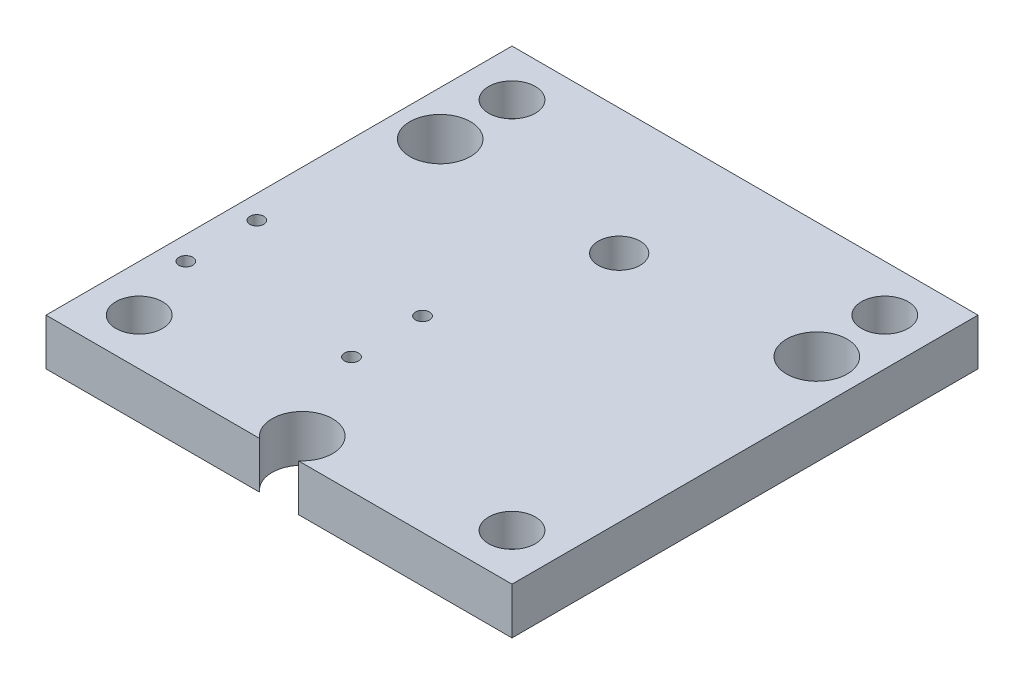
from build123d import *

# Parameters (mm, degrees)
SKETCH_1_W          = 100
SKETCH_1_H          = 100
EXTRUDE_1_DEPTH     = 10
SKETCH_2_R          = 5
CUT_EXTRUDE_1_DEPTH = 7
SKETCH_3_R          = 6.5
CUT_EXTRUDE_2_DEPTH = 142.774468788
SKETCH_4_R          = 4.5
CUT_EXTRUDE_3_DEPTH = 142.774468788
SKETCH_5_R          = 6.5
CUT_EXTRUDE_4_DEPTH = 3
SKETCH_6_R          = 1.5
CUT_EXTRUDE_5_DEPTH = 142.774468788
SKETCH_7_R          = 1.4
CUT_EXTRUDE_6_DEPTH = 5


with BuildPart() as part:
    # 草图1 → 凸台-拉伸1 (new body)
    with BuildSketch(Plane(origin=(0, 0, 0), x_dir=(1, 0, 0), z_dir=(0, 1, 0))):
        with Locations((50, -50)):
            Rectangle(SKETCH_1_W, SKETCH_1_H)
    extrude(amount=EXTRUDE_1_DEPTH)

    # 草图2 → 切除-拉伸1 (cut)
    with BuildSketch(Plane(origin=(0, 10, 0), x_dir=(1, 0, 0), z_dir=(0, 1, 0))):
        with Locations(Location((10, -10, 0), (0, 0, 270))):
            Circle(SKETCH_2_R)
        with Locations(Location((90, -10, 0), (0, 0, 270))):
            Circle(SKETCH_2_R)
        with Locations(Location((10, -90, 0), (0, 0, 270))):
            Circle(SKETCH_2_R)
        with Locations(Location((90, -90, 0), (0, 0, 270))):
            Circle(SKETCH_2_R)
    extrude(amount=-CUT_EXTRUDE_1_DEPTH, mode=Mode.SUBTRACT)

    # 草图3 → 切除-拉伸2 (cut, through all)
    with BuildSketch(Plane(origin=(0, 10, 0), x_dir=(1, 0, 0), z_dir=(0, 1, 0))):
        with Locations((50, -95)):
            Circle(SKETCH_3_R)
        with Locations(Location((90.414518843, -25, 0), (0, 0, 270))):
            Circle(SKETCH_3_R)
        with Locations(Location((9.585481157, -25, 0), (0, 0, 270))):
            Circle(SKETCH_3_R)
    extrude(amount=-CUT_EXTRUDE_2_DEPTH, mode=Mode.SUBTRACT)

    # 草图4 → 切除-拉伸3 (cut, through all)
    with BuildSketch(Plane(origin=(0, 10, 0), x_dir=(1, 0, 0), z_dir=(0, 1, 0))):
        with Locations(Location((50, -27, 0), (0, 0, 270))):
            Circle(SKETCH_4_R)
    extrude(amount=-CUT_EXTRUDE_3_DEPTH, mode=Mode.SUBTRACT)

    # 草图5 → 切除-拉伸4 (cut)
    with BuildSketch(Plane(origin=(0, 0, 0), x_dir=(-1, 0, 0), z_dir=(0, -1, 0))):
        with Locations(Location((-50, -27, 0), (0, 0, 90))):
            Circle(SKETCH_5_R)
    extrude(amount=-CUT_EXTRUDE_4_DEPTH, mode=Mode.SUBTRACT)

    # 草图6 → 切除-拉伸5 (cut, through all)
    with BuildSketch(Plane(origin=(0, 10, 0), x_dir=(1, 0, 0), z_dir=(0, 1, 0))):
        with Locations(Location((40.56, -59.76, 0), (0, 0, 270))):
            Circle(SKETCH_6_R)
        with Locations(Location((40.56, -75, 0), (0, 0, 270))):
            Circle(SKETCH_6_R)
        with Locations(Location((5, -59.76, 0), (0, 0, 270))):
            Circle(SKETCH_6_R)
        with Locations(Location((5, -75, 0), (0, 0, 270))):
            Circle(SKETCH_6_R)
    extrude(amount=-CUT_EXTRUDE_5_DEPTH, mode=Mode.SUBTRACT)

    # 草图7 → 切除-拉伸6 (cut)
    with BuildSketch(Plane(origin=(0, 0, 0), x_dir=(-1, 0, 0), z_dir=(0, -1, 0))):
        with Locations(Location((-65, -27, 0), (0, 0, 90))):
            Circle(SKETCH_7_R)
        with Locations(Location((-35, -27, 0), (0, 0, 90))):
            Circle(SKETCH_7_R)
    extrude(amount=-CUT_EXTRUDE_6_DEPTH, mode=Mode.SUBTRACT)


solid = part.part
